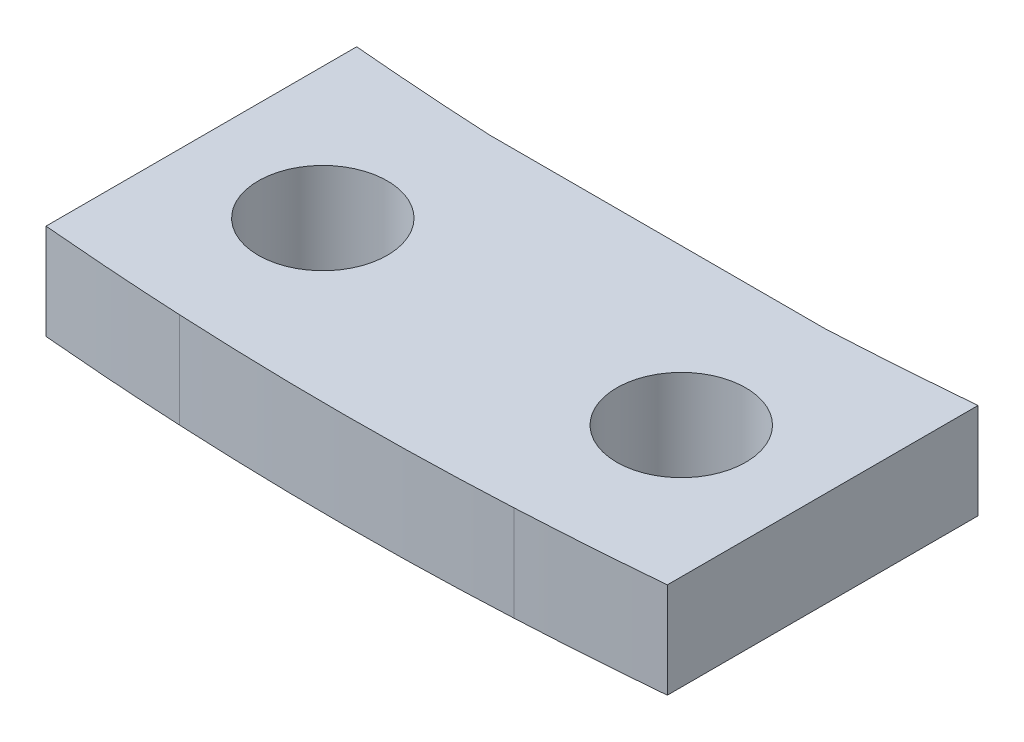
from build123d import *

# Parameters (mm, degrees)
SKETCH1_R           = 2.7
BOSS_EXTRUDE1_DEPTH = 4


with BuildPart() as part:
    # Sketch1 → Boss-Extrude1 (new body)
    with BuildSketch(Plane(origin=(0, 0, 0), x_dir=(1, 0, 0), z_dir=(0, 1, 0))):
        with BuildLine():
            Line((13, 6.916598833), (13, -6.083401167))
            add(Edge.make_bspline(
                [(13, -6.083401167), (11.881455284, -6.181548449), (9.882372116, -6.337878454), (7.880965391, -6.456052029), (7, -6.5)],
                knots=[0, 0, 0, 0, 0.56, 1, 1, 1, 1], degree=3))
            add(Edge.make_bspline(
                [(7, -6.5), (6.834819068, -6.508242741), (6.666566964, -6.516342005), (5.350428343, -6.577459909), (3.178772662, -6.652062078), (1.020954011, -6.676072233), (-0.278468619, -6.676071849), (-1.578970751, -6.672116146), (-3.740363082, -6.635008847), (-5.632474881, -6.564362453), (-6.66657307, -6.516341675), (-6.834821325, -6.50824259), (-6.999999228, -6.5)],
                knots=[0, 0, 0, 0, 0.036447922, 0.036447922, 0.28, 0.500000307, 0.500000307, 0.56, 0.78, 0.963552693, 0.963552693, 1, 1, 1, 1], degree=3))
            add(Edge.make_bspline(
                [(-6.999999228, -6.5), (-8.121293995, -6.444062922), (-10.122381008, -6.320906395), (-12.121162985, -6.160515106), (-12.999999228, -6.083401167)],
                knots=[0, 0, 0, 0, 0.56, 1, 1, 1, 1], degree=3))
            Line((-12.999999228, -6.083401167), (-12.999999614, 6.916598833))
            add(Edge.make_bspline(
                [(-12.999999614, 6.916598833), (-11.002598721, 6.741335829), (-9.00219407, 6.599881753), (-7, 6.5)],
                knots=[1.5e-08, 1.5e-08, 1.5e-08, 1.5e-08, 0.230998109, 0.230998109, 0.230998109, 0.230998109], degree=3))
            Line((-7, 6.5), (7, 6.5))
            add(Edge.make_bspline(
                [(7, 6.5), (9.00219407, 6.599881753), (11.002598721, 6.741335829), (13, 6.916598833)],
                knots=[0.769001891, 0.769001891, 0.769001891, 0.769001891, 1, 1, 1, 1], degree=3))
        make_face()
        with Locations(Location((-7.5, 0, 0), (0, 0, 270))):
            Circle(SKETCH1_R, mode=Mode.SUBTRACT)
        with Locations(Location((7.5, 0, 0), (0, 0, 270))):
            Circle(SKETCH1_R, mode=Mode.SUBTRACT)
    extrude(amount=BOSS_EXTRUDE1_DEPTH)


solid = part.part
